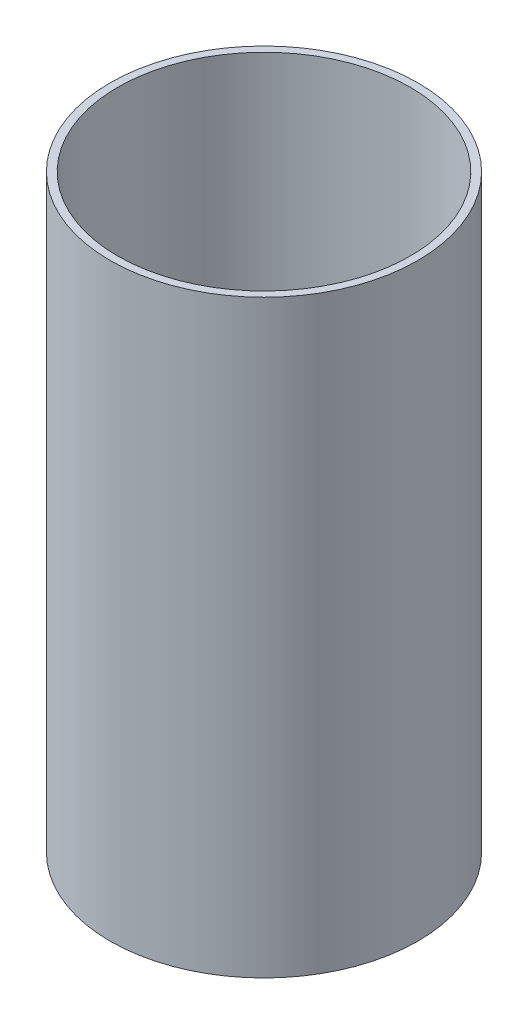
from build123d import *

# Parameters (mm, degrees)
SKETCH2_W          = 56.9
SKETCH2_H          = 218.001042519
SKETCH3_R          = 54.081739793
CUT_EXTRUDE1_DEPTH = 210
FILLET1_R          = 10


with BuildPart() as part:
    # Sketch2 → Revolve2 (revolve)
    with BuildSketch(Plane.XY, mode=Mode.PRIVATE) as revolve2_sk:
        with Locations((321.328943302, 175.938289097)):
            Rectangle(SKETCH2_W, SKETCH2_H)
    revolve(revolve2_sk.sketch.rotate(Axis((349.778943302, 284.938810356, 0), (0, -1, 0)), 270), axis=Axis((349.778943302, 284.938810356, 0), (0, -1, 0)))

    # Sketch3 → Cut-Extrude1 (cut)
    with BuildSketch(Plane(origin=(0, 284.938810356, 0), x_dir=(1, 0, 0), z_dir=(0, 1, 0))):
        with Locations(Location((349.778943302, 0, 0), (0, 0, 270))):
            Circle(SKETCH3_R)
    extrude(amount=-CUT_EXTRUDE1_DEPTH, mode=Mode.SUBTRACT)

    # Fillet1
    fillet1_edges = [part.edges().sort_by_distance(p)[0] for p in [
        (349.778943302, 74.938810356, -54.081739793),
    ]]
    fillet(fillet1_edges, radius=FILLET1_R)


solid = part.part
